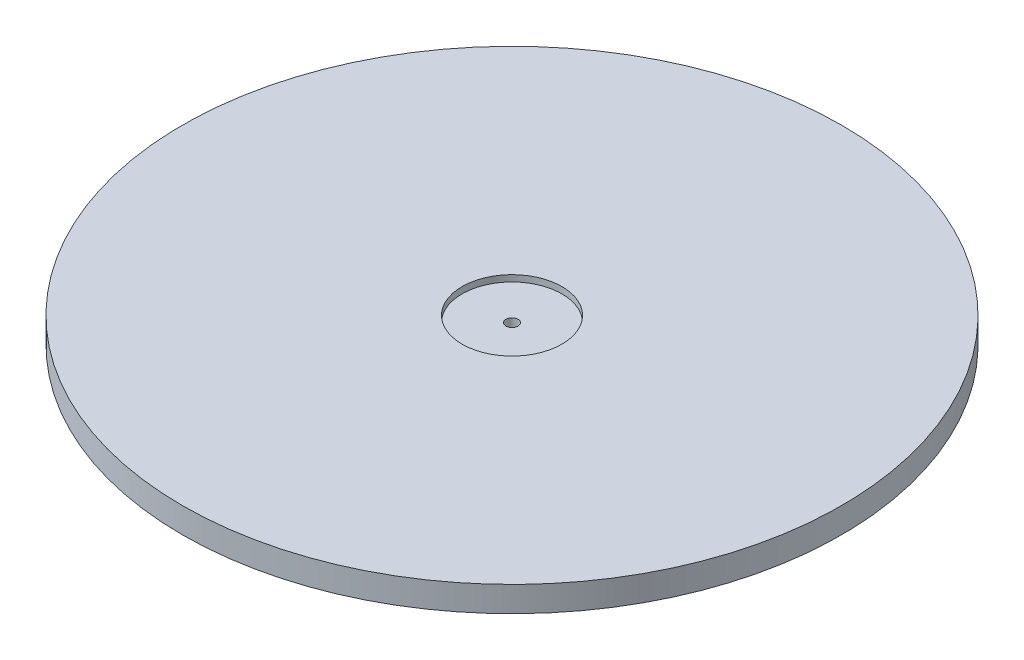
from build123d import *

# Parameters (mm, degrees)
SKETCH1_R           = 165.1
SKETCH1_R_2         = 3
BOSS_EXTRUDE1_DEPTH = 12.7
SKETCH7_R           = 165.1
SKETCH7_R_2         = 3
BOSS_EXTRUDE3_DEPTH = 6.35
SKETCH8_R           = 25
CUT_EXTRUDE1_DEPTH  = 6.35
CUT_EXTRUDE2_START  = -6.35
SKETCH9_R           = 25
CUT_EXTRUDE2_DEPTH  = 6.35
SKETCH10_R          = 165.1
CUT_EXTRUDE3_DEPTH  = 6.35
CUT_EXTRUDE5_START  = -3.175
SKETCH11_R          = 25
CUT_EXTRUDE5_DEPTH  = 3.175
BOSS_EXTRUDE4_START = 3.175
SKETCH12_R          = 25
BOSS_EXTRUDE4_DEPTH = 3.175
SKETCH13_R          = 3
CUT_EXTRUDE6_DEPTH  = 3.175


with BuildPart() as part:
    # Sketch1 → Boss-Extrude1 (new body)
    with BuildSketch(Plane(origin=(0, 0, 0), x_dir=(1, 0, 0), z_dir=(0, 1, 0))):
        with Locations(Location((0, 0, 0), (0, 0, 270))):
            Circle(SKETCH1_R)
        with Locations(Location((0, 0, 0), (0, 0, 270))):
            Circle(SKETCH1_R_2, mode=Mode.SUBTRACT)
    extrude(amount=BOSS_EXTRUDE1_DEPTH)

    # Sketch7 → Boss-Extrude3 (add)
    with BuildSketch(Plane(origin=(0, 12.7, 0), x_dir=(1, 0, 0), z_dir=(0, 1, 0))):
        with Locations(Location((0, 0, 0), (0, 0, 270))):
            Circle(SKETCH7_R)
        with Locations(Location((0, 0, 0), (0, 0, 270))):
            Circle(SKETCH7_R_2, mode=Mode.SUBTRACT)
    extrude(amount=BOSS_EXTRUDE3_DEPTH)

    # Sketch8 → Cut-Extrude1 (cut)
    with BuildSketch(Plane(origin=(0, 19.05, 0), x_dir=(1, 0, 0), z_dir=(0, 1, 0))):
        with Locations(Location((0, 0, 0), (0, 0, 270))):
            Circle(SKETCH8_R)
    extrude(amount=-CUT_EXTRUDE1_DEPTH, mode=Mode.SUBTRACT)

    # Sketch9 → Cut-Extrude2 (cut)
    with BuildSketch(Plane.XZ.offset(CUT_EXTRUDE2_START)):
        with Locations(Location((0, 0, 0), (0, 0, 90))):
            Circle(SKETCH9_R)
    extrude(amount=CUT_EXTRUDE2_DEPTH, mode=Mode.SUBTRACT)

    # Sketch10 → Cut-Extrude3 (cut)
    with BuildSketch(Plane.XZ):
        with Locations(Location((0, 0, 0), (0, 0, 270))):
            Circle(SKETCH10_R)
    extrude(amount=-CUT_EXTRUDE3_DEPTH, mode=Mode.SUBTRACT)

    # Sketch11 → Cut-Extrude5 (cut)
    with BuildSketch(Plane.XZ.offset(-6.35).offset(CUT_EXTRUDE5_START)):
        with Locations(Location((0, 0, 0), (0, 0, 90))):
            Circle(SKETCH11_R)
    extrude(amount=CUT_EXTRUDE5_DEPTH, mode=Mode.SUBTRACT)

    # Sketch12 → Boss-Extrude4 (add)
    with BuildSketch(Plane(origin=(0, 12.7, 0), x_dir=(1, 0, 0), z_dir=(0, 1, 0)).offset(BOSS_EXTRUDE4_START)):
        with Locations(Location((0, 0, 0), (0, 0, 270))):
            Circle(SKETCH12_R)
    extrude(amount=-BOSS_EXTRUDE4_DEPTH)

    # Sketch13 → Cut-Extrude6 (cut)
    with BuildSketch(Plane.XZ.offset(-12.7)):
        with Locations(Location((0, 0, 0), (0, 0, 270))):
            Circle(SKETCH13_R)
    extrude(amount=-CUT_EXTRUDE6_DEPTH, mode=Mode.SUBTRACT)


solid = part.part
